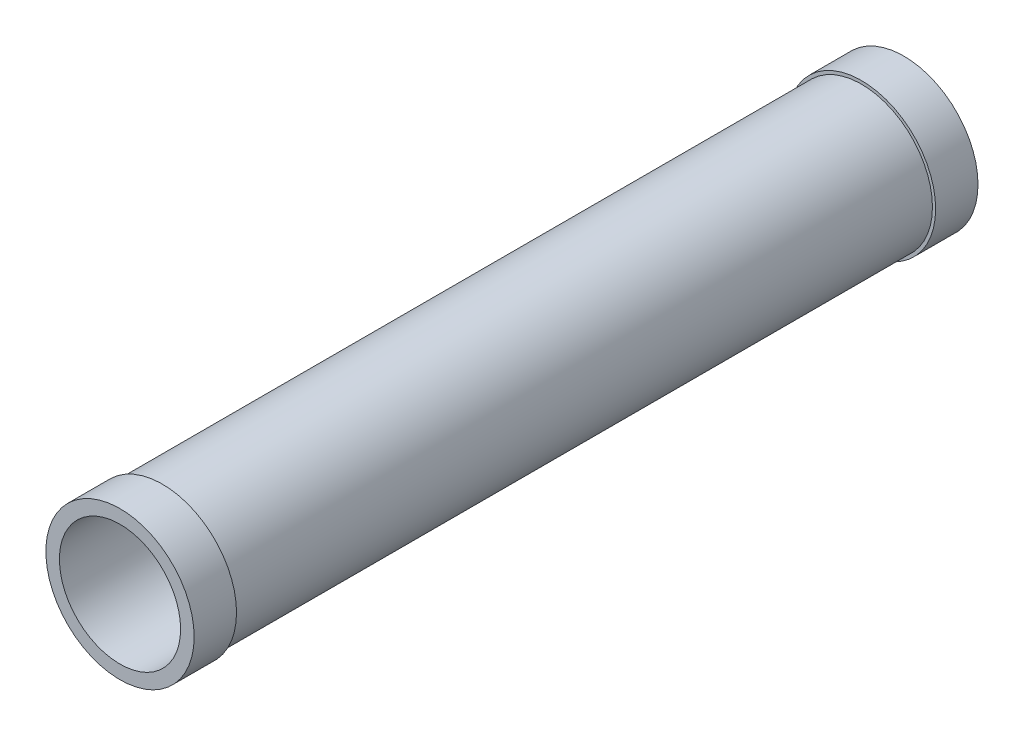
from build123d import *

# Parameters (mm, degrees)
ESQUISSE1_R             = 17.5
ESQUISSE1_R_2           = 14.3
BOSS_EXTRU_1_DEPTH      = 92.5
ESQUISSE2_OUTSIDE_W     = 75.302
ESQUISSE2_OUTSIDE_H     = 75.302
ESQUISSE2_OUTSIDE_R     = 16.75
ENL_V_MAT_EXTRU_1_DEPTH = 82.5


with BuildPart() as part:
    # Esquisse1 → Boss.-Extru.1 (new, symmetric)
    with BuildSketch(Plane.XY):
        Circle(ESQUISSE1_R)
        Circle(ESQUISSE1_R_2, mode=Mode.SUBTRACT)
    extrude(amount=BOSS_EXTRU_1_DEPTH, both=True)

    # Esquisse2 outside → Enlèv. mat.-Extru.1 (cut, symmetric)
    with BuildSketch(Plane.XY):
        Rectangle(ESQUISSE2_OUTSIDE_W, ESQUISSE2_OUTSIDE_H)
        Circle(ESQUISSE2_OUTSIDE_R, mode=Mode.SUBTRACT)
    extrude(amount=ENL_V_MAT_EXTRU_1_DEPTH, both=True, mode=Mode.SUBTRACT)


solid = part.part
